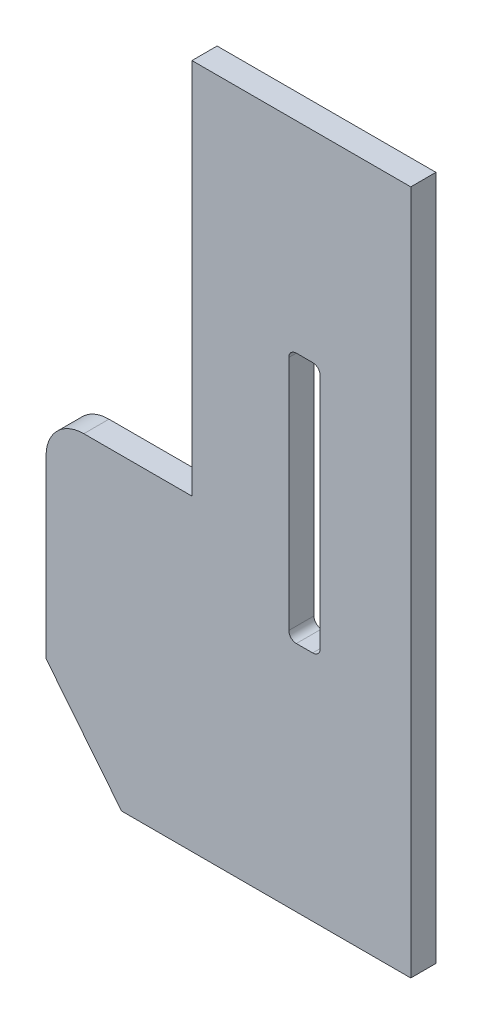
from build123d import *

# Parameters (mm, degrees)
SKETCH_1_W          = 145
SKETCH_1_H          = 272.434969596
EXTRUDE_1_DEPTH     = 10
SKETCH_2_W          = 58
SKETCH_2_H          = 150
SKETCH_2_W_2        = 12.5
SKETCH_2_H_2        = 100
CUT_EXTRUDE_1_DEPTH = 10
FILLET_1_R          = 15
FILLET_2_R          = 3


with BuildPart() as part:
    # 草图1 → 凸台-拉伸1 (new body)
    with BuildSketch(Plane.XY):
        Rectangle(SKETCH_1_W, SKETCH_1_H)
    extrude(amount=EXTRUDE_1_DEPTH)

    # 草图2 → 切除-拉伸1 (cut)
    with BuildSketch(Plane.XY):
        with Locations((-43.5, 61.217484798)):
            Rectangle(SKETCH_2_W, SKETCH_2_H)
        Polygon((-72.5, -98.782515202), (-72.5, -136.217484798), (-42.5, -136.217484798), align=None)
        with Locations((30.25, 6.217484798)):
            Rectangle(SKETCH_2_W_2, SKETCH_2_H_2)
    extrude(amount=CUT_EXTRUDE_1_DEPTH, mode=Mode.SUBTRACT)

    # 圆角1
    fillet_1_edges = [part.edges().sort_by_distance(p)[0] for p in [
        (-72.5, -13.782515202, 5),
    ]]
    fillet(fillet_1_edges, radius=FILLET_1_R)

    # 圆角2
    fillet_2_edges = [part.edges().sort_by_distance(p)[0] for p in [
        (36.5, -43.782515202, 5),
        (36.5, 56.217484798, 5),
        (24, 56.217484798, 5),
        (24, -43.782515202, 5),
    ]]
    fillet(fillet_2_edges, radius=FILLET_2_R)


solid = part.part
